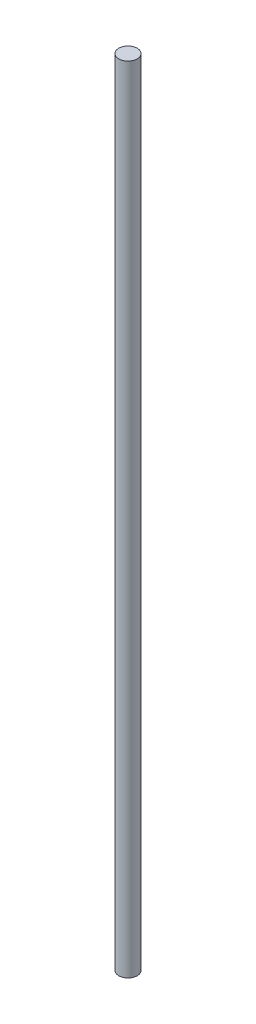
from build123d import *

# Parameters (mm, degrees)
CROQUIS1_R              = 4
SALIENTE_EXTRUIR1_DEPTH = 344


with BuildPart() as part:
    # Croquis1 → Saliente-Extruir1 (new body)
    with BuildSketch(Plane(origin=(0, 0, 0), x_dir=(1, 0, 0), z_dir=(0, 1, 0))):
        with Locations(Location((0, 0, 0), (0, 0, 270))):
            Circle(CROQUIS1_R)
    extrude(amount=SALIENTE_EXTRUIR1_DEPTH)


solid = part.part
